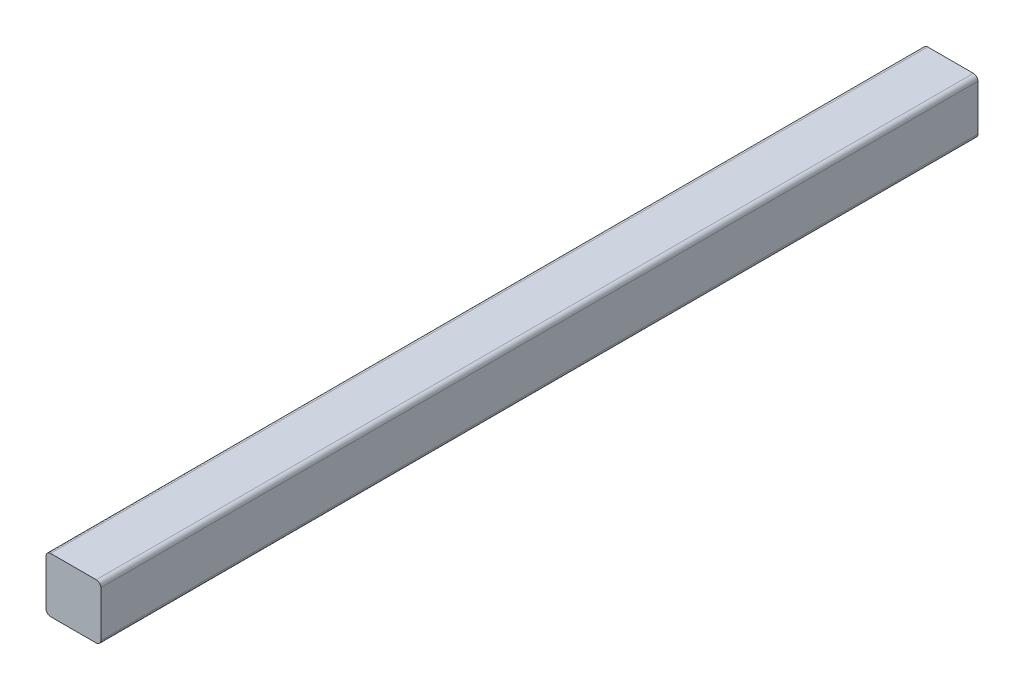
from build123d import *

# Parameters (mm, degrees)
SKETCH1_W           = 38.1
SKETCH1_H           = 38.1
BOSS_EXTRUDE1_DEPTH = 609.6
FILLET1_R           = 3.175


with BuildPart() as part:
    # Sketch1 → Boss-Extrude1 (new body)
    with BuildSketch(Plane.XY):
        Rectangle(SKETCH1_W, SKETCH1_H)
    extrude(amount=BOSS_EXTRUDE1_DEPTH)

    # Fillet1
    fillet1_edges = [part.edges().sort_by_distance(p)[0] for p in [
        (19.05, -19.05, 304.8),
        (-19.05, -19.05, 304.8),
        (-19.05, 19.05, 304.8),
        (19.05, 19.05, 304.8),
    ]]
    fillet(fillet1_edges, radius=FILLET1_R)


solid = part.part
